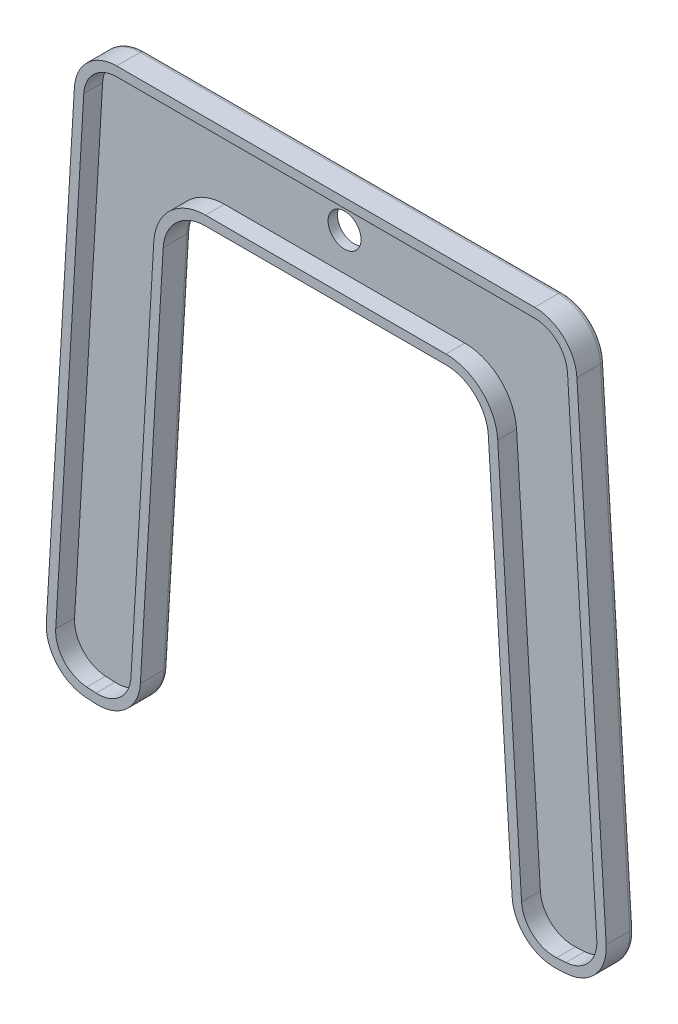
from build123d import *

# Parameters (mm, degrees)
ESQUISSE1_R        = 3.5
BOSS_EXTRU_1_DEPTH = 2
BOSS_EXTRU_2_START = 2
BOSS_EXTRU_2_DEPTH = 4
CONG_1_R           = 1


with BuildPart() as part:
    # Esquisse1 → Boss.-Extru.1 (new body)
    with BuildSketch(Plane.XY):
        with BuildLine():
            Line((8.486931566, 0), (59.535501901, 0))
            ThreePointArc((59.535501901, 0), (65.701431316, -2.44398639), (68.518594603, -8.448596789))
            Line((68.518594603, -8.448596789), (73.575299132, -90.829048435))
            ThreePointArc((73.575299132, -90.829048435), (76.596287018, -97.01955194), (83.109795045, -99.260737926))
            Line((83.109795045, -99.260737926), (85.106037868, -99.13820388))
            ThreePointArc((85.106037868, -99.13820388), (91.296541372, -96.117215994), (93.537727359, -89.603707966))
            Line((93.537727359, -89.603707966), (87.328590379, 11.551403211))
            ThreePointArc((87.328590379, 11.551403211), (84.511427092, 17.55601361), (78.345497677, 20))
            Line((78.345497677, 20), (-10.372916358, 20))
            ThreePointArc((-10.372916358, 20), (-16.547500996, 17.547862594), (-19.357434532, 11.527667678))
            Line((-19.357434532, 11.527667678), (-25.311005353, -89.842886985))
            ThreePointArc((-25.311005353, -89.842886985), (-23.052618299, -96.350450996), (-16.854154857, -99.355072837))
            Line((-16.854154857, -99.355072837), (-14.857595263, -99.472332322))
            ThreePointArc((-14.857595263, -99.472332322), (-8.350031252, -97.213945268), (-5.34540941, -91.015481826))
            Line((-5.34540941, -91.015481826), (-0.497586608, -8.472332322))
            ThreePointArc((-0.497586608, -8.472332322), (2.312346928, -2.452137406), (8.486931566, 0))
        make_face()
        with Locations((33.998753696, 10)):
            Circle(ESQUISSE1_R, mode=Mode.SUBTRACT)
    extrude(amount=BOSS_EXTRU_1_DEPTH)

    # Esquisse1<4> → Boss.-Extru.2 (add)
    with BuildSketch(Plane.XY.offset(BOSS_EXTRU_2_START)):
        with BuildLine():
            Line((8.486931566, 0), (59.535501901, 0))
            ThreePointArc((59.535501901, 0), (65.701431316, -2.44398639), (68.518594603, -8.448596789))
            Line((68.518594603, -8.448596789), (73.575299132, -90.829048435))
            ThreePointArc((73.575299132, -90.829048435), (76.596287018, -97.01955194), (83.109795045, -99.260737926))
            Line((83.109795045, -99.260737926), (85.106037868, -99.13820388))
            ThreePointArc((85.106037868, -99.13820388), (91.296541372, -96.117215994), (93.537727359, -89.603707966))
            Line((93.537727359, -89.603707966), (87.328590379, 11.551403211))
            ThreePointArc((87.328590379, 11.551403211), (84.511427092, 17.55601361), (78.345497677, 20))
            Line((78.345497677, 20), (-10.372916358, 20))
            ThreePointArc((-10.372916358, 20), (-16.547500996, 17.547862594), (-19.357434532, 11.527667678))
            Line((-19.357434532, 11.527667678), (-25.311005353, -89.842886985))
            ThreePointArc((-25.311005353, -89.842886985), (-23.052618299, -96.350450996), (-16.854154857, -99.355072837))
            Line((-16.854154857, -99.355072837), (-14.857595263, -99.472332322))
            ThreePointArc((-14.857595263, -99.472332322), (-8.350031252, -97.213945268), (-5.34540941, -91.015481826))
            Line((-5.34540941, -91.015481826), (-0.497586608, -8.472332322))
            ThreePointArc((-0.497586608, -8.472332322), (2.312346928, -2.452137406), (8.486931566, 0))
        make_face()
        with BuildLine():
            Line((-10.372916358, 18), (78.345497677, 18))
            ThreePointArc((78.345497677, 18), (83.141220555, 16.099121696), (85.332347556, 11.428869164))
            Line((85.332347556, 11.428869164), (91.541484536, -89.726242013))
            ThreePointArc((91.541484536, -89.726242013), (89.79833988, -94.792303812), (84.983503821, -97.141961057))
            Line((84.983503821, -97.141961057), (82.987260998, -97.264495104))
            ThreePointArc((82.987260998, -97.264495104), (77.921199199, -95.521350447), (75.571541954, -90.706514388))
            Line((75.571541954, -90.706514388), (70.514837426, -8.326062742))
            ThreePointArc((70.514837426, -8.326062742), (67.071637853, -0.987094477), (59.535501901, 2))
            Line((59.535501901, 2), (8.486931566, 2))
            ThreePointArc((8.486931566, 2), (0.940217009, -0.997056829), (-2.494146203, -8.355072837))
            Line((-2.494146203, -8.355072837), (-7.341969005, -90.898222342))
            ThreePointArc((-7.341969005, -90.898222342), (-9.678897103, -95.719249463), (-14.740335779, -97.475772727))
            Line((-14.740335779, -97.475772727), (-16.736895373, -97.358513243))
            ThreePointArc((-16.736895373, -97.358513243), (-21.557922495, -95.021585145), (-23.314445759, -89.960146469))
            Line((-23.314445759, -89.960146469), (-17.360874938, 11.410408194))
            ThreePointArc((-17.360874938, 11.410408194), (-15.175371076, 16.092782018), (-10.372916358, 18))
        make_face(mode=Mode.SUBTRACT)
    extrude(amount=BOSS_EXTRU_2_DEPTH)

    # Congé1
    cong_1_edges = [part.edges().sort_by_distance(p)[0] for p in [
        (-22.334219943, -39.157609653, 0),
        (-23.052618299, -96.350450996, 0),
        (-15.85587506, -99.41370258, 0),
        (-8.350031252, -97.213945268, 0),
        (-2.921498009, -49.743907074, 0),
        (2.312346928, -2.452137406, 0),
        (34.011216733, 0, 0),
        (65.701431316, -2.44398639, 0),
        (71.046946867, -49.638822612, 0),
        (76.596287018, -97.01955194, 0),
        (84.107916456, -99.199470903, 0),
        (91.296541372, -96.117215994, 0),
        (90.433158869, -39.026152378, 0),
        (84.511427092, 17.55601361, 0),
        (33.986290659, 20, 0),
        (-16.547500996, 17.547862594, 0),
    ]]
    fillet(cong_1_edges, radius=CONG_1_R)


solid = part.part
